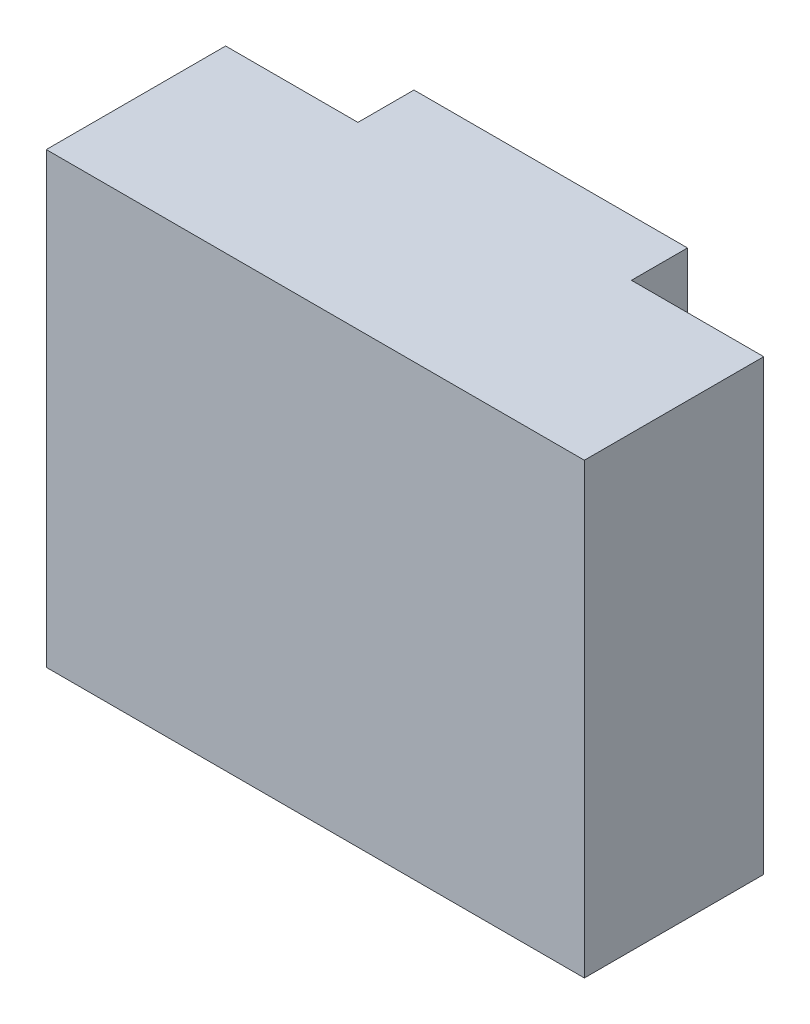
from build123d import *

# Parameters (mm, degrees)
BOSS_EXTRUDE1_DEPTH = 20


with BuildPart() as part:
    # Sketch1 → Boss-Extrude1 (new body)
    with BuildSketch(Plane(origin=(0, 0, 0), x_dir=(1, 0, 0), z_dir=(0, 1, 0))):
        Polygon((-12, 0), (12, 0), (12, 8), (6.1, 8), (6.1, 10.5), (-6.1, 10.5), (-6.1, 8), (-12, 8), align=None)
    extrude(amount=BOSS_EXTRUDE1_DEPTH)


solid = part.part
